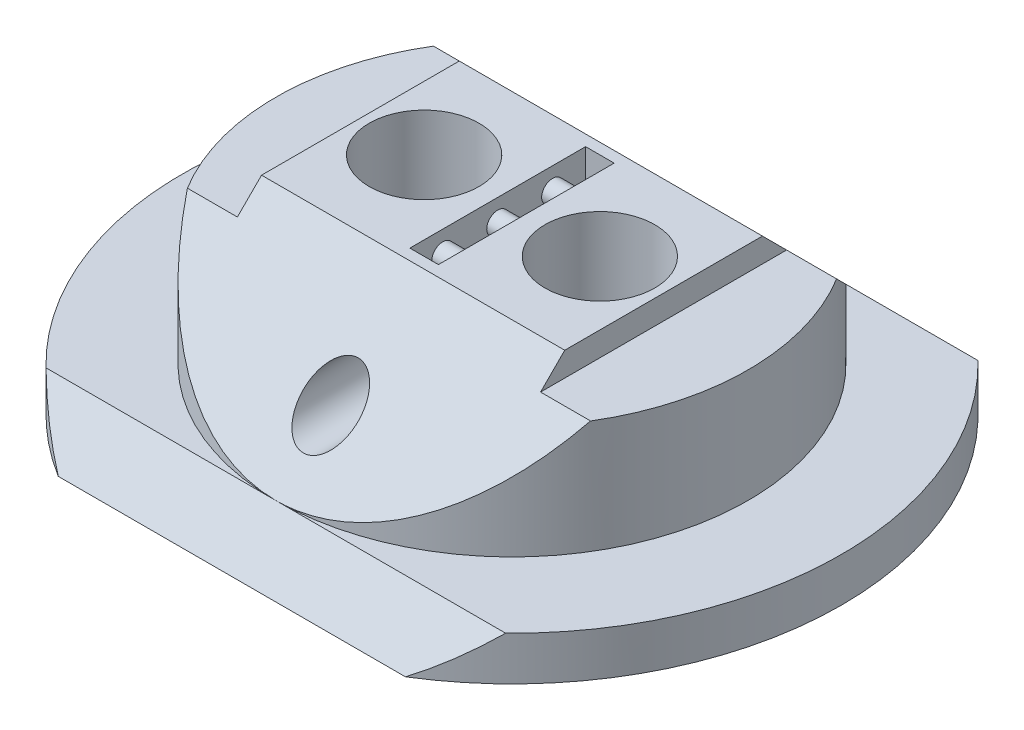
from build123d import *
from build123d.topology import SkipClean

# Parameters (mm, degrees)
SKETCH1_R                            = 30
BOSS_EXTRUDE1_DEPTH                  = 4
BOSS_EXTRUDE2_REACH                  = 44.615
BOSS_EXTRUDE2_END_RADIUS             = 30
BOSS_EXTRUDE2_DIRECTION_2_REACH      = 44.615
BOSS_EXTRUDE2_DIRECTION_2_END_RADIUS = 30
SKETCH3_OUTSIDE_W                    = 78.092
SKETCH3_OUTSIDE_H                    = 69.092
SKETCH3_OUTSIDE_R                    = 21.5
CUT_EXTRUDE2_DEPTH                   = 12.5
BOSS_EXTRUDE3_DEPTH                  = 18
BOSS_EXTRUDE4_DEPTH                  = 15
BOSS_EXTRUDE5_DEPTH                  = 15
CUT_EXTRUDE3_DEPTH                   = 44.292609069
CUT_EXTRUDE3_DEPTH_BACK              = 44.292609069
SKETCH8_R                            = 2
CUT_EXTRUDE8_DEPTH                   = 48.077064479
CUT_EXTRUDE8_DEPTH_BACK              = 48.077064479
CUT_EXTRUDE9_DEPTH                   = 59.659818207
CUT_EXTRUDE11_DEPTH                  = 20
CUT_EXTRUDE12_DEPTH                  = 20
CUT_EXTRUDE13_DEPTH                  = 20
CUT_EXTRUDE14_DEPTH                  = 44.292609069
CUT_EXTRUDE14_DEPTH_BACK             = 44.292609069
SKETCH25_W                           = 66.075437062
SKETCH25_H                           = 20.142243048
SKETCH26_R                           = 5
CUT_EXTRUDE15_DEPTH                  = 24
CUT_EXTRUDE17_DEPTH                  = 47.524187258
CUT_EXTRUDE17_DEPTH_BACK             = 47.524187258
SKETCH29_W                           = 7.7
SKETCH29_H                           = 2.2
CUT_EXTRUDE18_DEPTH                  = 47.524187258
CUT_EXTRUDE18_DEPTH_BACK             = 47.524187258
SKETCH31_W                           = 7.7
SKETCH31_H                           = 2.2
CUT_EXTRUDE20_DEPTH                  = 43.690748412
CUT_EXTRUDE20_DEPTH_BACK             = 43.690748412
SKETCH33_R                           = 2.5
SKETCH34_R                           = 1.5
CUT_EXTRUDE21_DEPTH                  = 10
SKETCH35_W                           = 2.6
SKETCH35_H                           = 16
CUT_EXTRUDE23_DEPTH                  = 4
BOSS_EXTRUDE6_REACH                  = 45.614
SKETCH37_R                           = 1


with BuildPart() as part:
    # Sketch1 → Boss-Extrude1 (new body)
    with BuildSketch(Plane(origin=(0, 0, 0), x_dir=(1, 0, 0), z_dir=(0, 1, 0))):
        with Locations(Location((0, 0, 0), (0, 0, 270))):
            Circle(SKETCH1_R)
    extrude(amount=BOSS_EXTRUDE1_DEPTH)

    # Boss-Extrude2: up to this cylinder (the profile starts inside it)
    with SkipClean():  # the faces are left unmerged after this step: merging them gives an invalid solid
        boss_extrude2_end = Plane(origin=(0, 9.396175, 0), z_dir=(0, -1, 0)) * Cylinder(BOSS_EXTRUDE2_END_RADIUS, 150.23, mode=Mode.PRIVATE)
        # Sketch2 → Boss-Extrude2 (add, up to the surface)
        with BuildSketch(Plane(origin=(0, 0, 0), x_dir=(0, 0, -1), z_dir=(1, 0, 0)), mode=Mode.PRIVATE) as boss_extrude2_sk1:
            Polygon((0, 4), (21.5, 4), (9, 16.5), (-9, 16.5), (-21.5, 4), align=None)
        boss_extrude2_tool1 = extrude(boss_extrude2_sk1.sketch, amount=BOSS_EXTRUDE2_REACH, mode=Mode.PRIVATE) & boss_extrude2_end
        add(boss_extrude2_tool1.solids().sort_by_distance((0, 9.396175, 0))[0])

    # Boss-Extrude2 direction 2: up to this cylinder (the profile starts inside it)
    with SkipClean():  # the faces are left unmerged after this step: merging them gives an invalid solid
        boss_extrude2_direction_2_end = Plane(origin=(0, 9.396175, 0), z_dir=(0, -1, 0)) * Cylinder(BOSS_EXTRUDE2_DIRECTION_2_END_RADIUS, 150.23, mode=Mode.PRIVATE)
        # Sketch2 → Boss-Extrude2 direction 2 (add, up to the surface)
        with BuildSketch(Plane(origin=(0, 0, 0), x_dir=(0, 0, -1), z_dir=(1, 0, 0)), mode=Mode.PRIVATE) as boss_extrude2_direction_2_sk1:
            Polygon((0, 4), (21.5, 4), (9, 16.5), (-9, 16.5), (-21.5, 4), align=None)
        boss_extrude2_direction_2_tool1 = extrude(boss_extrude2_direction_2_sk1.sketch, amount=-BOSS_EXTRUDE2_DIRECTION_2_REACH, mode=Mode.PRIVATE) & boss_extrude2_direction_2_end
        add(boss_extrude2_direction_2_tool1.solids().sort_by_distance((0, 9.396175, 0))[0])

    # SurfaceCut1
    split(bisect_by=Plane(origin=(0, 12.75, -12.75), x_dir=(1, 0, 0), z_dir=(0, 0.7071067811865558, -0.7071067811865392)), keep=Keep.BOTTOM)

    # SurfaceCut2
    split(bisect_by=Plane(origin=(0, 12.75, 12.75), x_dir=(1, 0, 0), z_dir=(0, 0.7071067811865509, 0.7071067811865442)), keep=Keep.BOTTOM)

    # Sketch3 outside → Cut-Extrude2 (cut)
    with BuildSketch(Plane(origin=(0, 4, 0), x_dir=(1, 0, 0), z_dir=(0, 1, 0))):
        Rectangle(SKETCH3_OUTSIDE_W, SKETCH3_OUTSIDE_H)
        Circle(SKETCH3_OUTSIDE_R, mode=Mode.SUBTRACT)
    extrude(amount=CUT_EXTRUDE2_DEPTH, mode=Mode.SUBTRACT)

    # Sketch5 → Boss-Extrude3 (add)
    with BuildSketch(Plane(origin=(0, 0, 0), x_dir=(-1, 0, 0), z_dir=(0, -1, 0))):
        Polygon((0, -6), (-17.5, -6), (-17.5, 6), (17.5, 6), (17.5, -6), align=None)
    extrude(amount=BOSS_EXTRUDE3_DEPTH)

    # Sketch6 → Boss-Extrude4 (add)
    with BuildSketch(Plane.XZ):
        Polygon((0, 15), (7, 15), (7, 6), (-7, 6), (-7, 15), align=None)
    extrude(amount=BOSS_EXTRUDE4_DEPTH)

    # Sketch7 → Boss-Extrude5 (add)
    with BuildSketch(Plane.XZ):
        Polygon((0, -15), (7, -15), (7, -6), (-7, -6), (-7, -15), align=None)
    extrude(amount=BOSS_EXTRUDE5_DEPTH)

    # Sketch8 → Cut-Extrude3 (cut, two sides: drawn at the far end of the back side and taken through both)
    with BuildSketch(Plane.XY.offset(-CUT_EXTRUDE3_DEPTH_BACK)):
        with Locations((-12.5, -12.5)):
            Circle(SKETCH8_R)
        with Locations((12.5, -12.5)):
            Circle(SKETCH8_R)
    extrude(amount=CUT_EXTRUDE3_DEPTH + CUT_EXTRUDE3_DEPTH_BACK, mode=Mode.SUBTRACT)

    # Sketch16 → Cut-Extrude8 (cut, two sides: drawn at the far end of the back side and taken through both)
    with BuildSketch(Plane.XY.offset(6).offset(-CUT_EXTRUDE8_DEPTH_BACK)):
        Polygon((17.5, -18), (17.5, -14.5), (14, -18), align=None)
        Polygon((-17.5, -18), (-14, -18), (-17.5, -14.5), align=None)
    extrude(amount=CUT_EXTRUDE8_DEPTH + CUT_EXTRUDE8_DEPTH_BACK, mode=Mode.SUBTRACT)

    # Sketch17 → Cut-Extrude9 (cut, through all)
    with BuildSketch(Plane(origin=(10.365975269, -9.674910251, -8.062425209), x_dir=(-0.3613483622370374, 0.337258471421235, -0.8693009171531012), z_dir=(0.6355070151731325, -0.5931398808282571, -0.49428323402354774))):
        Polygon((-2.372510104, -6.189601271), (7.980636686, -0.706686759), (7.980636686, -10.965829024), align=None)
    extrude(amount=CUT_EXTRUDE9_DEPTH, mode=Mode.SUBTRACT)

    # Sketch19 → Cut-Extrude11 (cut)
    with BuildSketch(Plane(origin=(-10.365975269, -9.674910251, -8.062425209), x_dir=(0.3613483622370374, 0.33725847142123494, -0.8693009171531012), z_dir=(0.6355070151731324, 0.5931398808282571, 0.4942832340235476))):
        Polygon((-2.372510104, -6.189601271), (7.980636686, -10.965829024), (7.980636686, -0.706686759), align=None)
    extrude(amount=-CUT_EXTRUDE11_DEPTH, mode=Mode.SUBTRACT)

    # Sketch20 → Cut-Extrude12 (cut)
    with BuildSketch(Plane(origin=(-10.365975269, -9.674910251, 8.062425209), x_dir=(-0.3613483622370374, -0.3372584714212349, -0.8693009171531013), z_dir=(0.6355070151731326, 0.593139880828257, -0.49428323402354757))):
        Polygon((2.372510104, -6.189601271), (-7.980636686, -0.706686759), (-7.980636686, -10.965829024), align=None)
    extrude(amount=-CUT_EXTRUDE12_DEPTH, mode=Mode.SUBTRACT)

    # Sketch21 → Cut-Extrude13 (cut)
    with BuildSketch(Plane(origin=(10.365975269, -9.674910251, 8.062425209), x_dir=(-0.3613483622370374, 0.3372584714212349, 0.8693009171531013), z_dir=(-0.6355070151731326, 0.593139880828257, -0.49428323402354757))):
        Polygon((-2.372510104, -6.189601271), (7.980636686, -0.706686759), (7.980636686, -10.965829024), align=None)
    extrude(amount=-CUT_EXTRUDE13_DEPTH, mode=Mode.SUBTRACT)

    # Sketch25 → Cut-Extrude14 (cut, two sides: drawn at the far end of the back side and taken through both)
    with BuildSketch(Plane.XY.offset(-CUT_EXTRUDE14_DEPTH_BACK)):
        with Locations((0, -10.071121524)):
            Rectangle(SKETCH25_W, SKETCH25_H)
    extrude(amount=CUT_EXTRUDE14_DEPTH + CUT_EXTRUDE14_DEPTH_BACK, mode=Mode.SUBTRACT)

    # Sketch26 → Cut-Extrude15 (cut)
    with BuildSketch(Plane(origin=(0, 16.5, 0), x_dir=(1, 0, 0), z_dir=(0, 1, 0))):
        with Locations(Location((-8, 0, 0), (0, 0, 270))):
            Circle(SKETCH26_R)
        with Locations(Location((8, 0, 0), (0, 0, 270))):
            Circle(SKETCH26_R)
    extrude(amount=-CUT_EXTRUDE15_DEPTH, mode=Mode.SUBTRACT)

    # Sketch29 → Cut-Extrude17 (cut, two sides: drawn at the far end of the back side and taken through both)
    with BuildSketch(Plane.XY.offset(6).offset(-CUT_EXTRUDE17_DEPTH_BACK)):
        with Locations((17.65, 15.4)):
            Rectangle(SKETCH29_W, SKETCH29_H)
    extrude(amount=CUT_EXTRUDE17_DEPTH + CUT_EXTRUDE17_DEPTH_BACK, mode=Mode.SUBTRACT)

    # Sketch31 → Cut-Extrude18 (cut, two sides: drawn at the far end of the back side and taken through both)
    with BuildSketch(Plane.XY.offset(6).offset(-CUT_EXTRUDE18_DEPTH_BACK)):
        with Locations((-17.65, 15.4)):
            Rectangle(SKETCH31_W, SKETCH31_H)
    extrude(amount=CUT_EXTRUDE18_DEPTH + CUT_EXTRUDE18_DEPTH_BACK, mode=Mode.SUBTRACT)

    # Sketch33 → Cut-Extrude20 (cut, two sides: drawn at the far end of the back side and taken through both)
    with BuildSketch(Plane.XY.offset(-CUT_EXTRUDE20_DEPTH_BACK)):
        with Locations(Location((0, 9, 0), (0, 0, 270))):
            Circle(SKETCH33_R)
    extrude(amount=CUT_EXTRUDE20_DEPTH + CUT_EXTRUDE20_DEPTH_BACK, mode=Mode.SUBTRACT)

    # Sketch34 → Cut-Extrude21 (cut)
    with BuildSketch(Plane.XZ):
        with Locations(Location((0, 0, 0), (0, 0, 270))):
            Circle(SKETCH34_R)
    extrude(amount=-CUT_EXTRUDE21_DEPTH, mode=Mode.SUBTRACT)

    # Sketch35 → Cut-Extrude23 (cut)
    with BuildSketch(Plane(origin=(0, 16.5, 0), x_dir=(1, 0, 0), z_dir=(0, 1, 0))):
        Rectangle(SKETCH35_W, SKETCH35_H)
    extrude(amount=-CUT_EXTRUDE23_DEPTH, mode=Mode.SUBTRACT)

    # Sketch37 → Boss-Extrude6 (add, up to next)
    with BuildSketch(Plane(origin=(-1.3, 0, 0), x_dir=(0, 0, -1), z_dir=(1, 0, 0)), mode=Mode.PRIVATE) as boss_extrude6_sk1:
        with Locations(Location((-5, 14.5, 0), (0, 0, 180))):
            Circle(SKETCH37_R)
    boss_extrude6_tool1 = extrude(boss_extrude6_sk1.sketch, amount=BOSS_EXTRUDE6_REACH, mode=Mode.PRIVATE) - part.part
    # Sketch37 → Boss-Extrude6 (add, up to next)
    with BuildSketch(Plane(origin=(-1.3, 0, 0), x_dir=(0, 0, -1), z_dir=(1, 0, 0)), mode=Mode.PRIVATE) as boss_extrude6_sk2:
        with Locations(Location((0, 14.5, 0), (0, 0, 180))):
            Circle(SKETCH37_R)
    boss_extrude6_tool2 = extrude(boss_extrude6_sk2.sketch, amount=BOSS_EXTRUDE6_REACH, mode=Mode.PRIVATE) - part.part
    # Sketch37 → Boss-Extrude6 (add, up to next)
    with BuildSketch(Plane(origin=(-1.3, 0, 0), x_dir=(0, 0, -1), z_dir=(1, 0, 0)), mode=Mode.PRIVATE) as boss_extrude6_sk3:
        with Locations(Location((5, 14.5, 0), (0, 0, 180))):
            Circle(SKETCH37_R)
    boss_extrude6_tool3 = extrude(boss_extrude6_sk3.sketch, amount=BOSS_EXTRUDE6_REACH, mode=Mode.PRIVATE) - part.part
    add(boss_extrude6_tool1.solids().sort_by_distance((-1.3, 14.5, 5))[0])
    add(boss_extrude6_tool2.solids().sort_by_distance((-1.3, 14.5, 0))[0])
    add(boss_extrude6_tool3.solids().sort_by_distance((-1.3, 14.5, -5))[0])


solid = part.part
